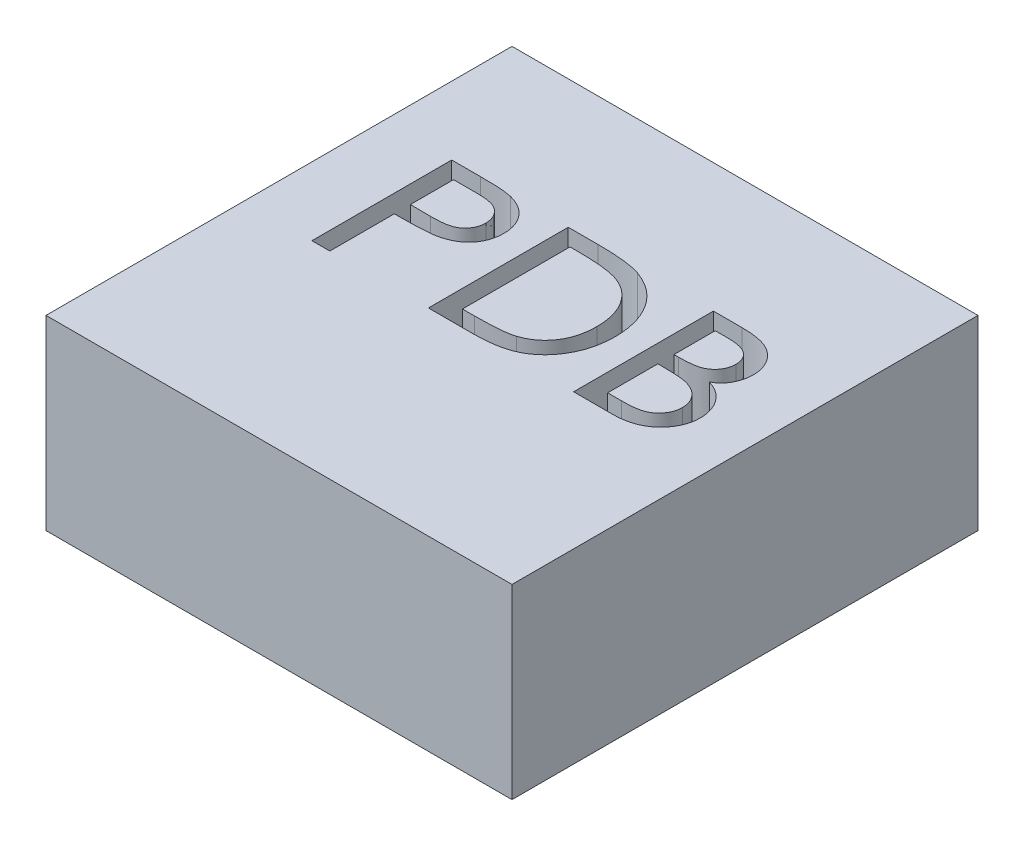
from build123d import *

# Parameters (mm, degrees)
SKETCH1_W           = 63.5
SKETCH1_H           = 63.5
BOSS_EXTRUDE1_DEPTH = 25.4
CUT_EXTRUDE1_DEPTH  = 12.7


with BuildPart() as part:
    # Sketch1 → Boss-Extrude1 (new body)
    with BuildSketch(Plane(origin=(0, 0, 0), x_dir=(1, 0, 0), z_dir=(0, 1, 0))):
        Rectangle(SKETCH1_W, SKETCH1_H)
    extrude(amount=BOSS_EXTRUDE1_DEPTH)

    # Sketch2 → Cut-Extrude1 (cut, symmetric)
    # profile 1 of 3: a face of its own
    with BuildSketch(Plane(origin=(0, 25.4, 0), x_dir=(1, 0, 0), z_dir=(0, 1, 0))):
        with BuildLine():
            Line((-22.444527911, 14.230872875), (-18.540651709, 14.230872875))
            add(Edge.make_bspline(
                [(-18.540651709, 14.230872875), (-18.282413534, 14.230732191), (-17.787511205, 14.230462577), (-17.077768337, 14.212192651), (-16.433871736, 14.196424192), (-15.854870009, 14.166115864), (-15.342081402, 14.124599264), (-14.895321834, 14.075780717), (-14.514111614, 14.020873337), (-14.284211976, 13.971232687), (-14.178842814, 13.948481048)],
                knots=[0, 0, 0, 0, 1.415450773, 2.712650385, 3.891531898, 4.945867971, 5.890285756, 6.71109784, 7.409261617, 8, 8, 8, 8], degree=3))
            add(Edge.make_bspline(
                [(-14.178842814, 13.948481048), (-14.030510742, 13.910336617), (-13.73789703, 13.835089347), (-13.319594841, 13.679982469), (-12.922682571, 13.503735476), (-12.548515352, 13.303248561), (-12.200915151, 13.071696923), (-11.872382672, 12.820119694), (-11.573023079, 12.535792454), (-11.292580558, 12.232508547), (-11.046518674, 11.903340726), (-10.826046516, 11.559427038), (-10.643308629, 11.195772234), (-10.493129004, 10.813728985), (-10.37572816, 10.415289186), (-10.291280039, 9.999183346), (-10.240536075, 9.566323923), (-10.235536068, 9.271346218), (-10.232989449, 9.12110725)],
                knots=[0, 0, 0, 0, 1.085641105, 2.141637125, 3.15936318, 4.164535163, 5.147931294, 6.118832473, 7.09541784, 8.072503165, 9.045079613, 10.006206652, 10.966486436, 11.926469503, 12.914201526, 13.908586125, 14.934794539, 16, 16, 16, 16], degree=3))
            add(Edge.make_bspline(
                [(-10.232989449, 9.12110725), (-10.23559194, 8.970875281), (-10.240723543, 8.674647164), (-10.291147068, 8.239200047), (-10.375671719, 7.8222298), (-10.489626704, 7.421894379), (-10.639388836, 7.040683537), (-10.818342186, 6.675378959), (-11.034662469, 6.330119459), (-11.281617579, 6.002508568), (-11.560500369, 5.697580965), (-11.867269054, 5.416494031), (-12.205956015, 5.16415684), (-12.573087622, 4.936040197), (-12.967384599, 4.728143957), (-13.39281361, 4.549330373), (-13.847476609, 4.396964169), (-14.163022987, 4.315946883), (-14.323854834, 4.274652923)],
                knots=[0, 0, 0, 0, 1.042501879, 2.055610221, 3.037454288, 3.993184118, 4.940927036, 5.876790881, 6.812738028, 7.76458517, 8.720845088, 9.677105007, 10.648370915, 11.647960469, 12.67482723, 13.739162042, 14.847666245, 16, 16, 16, 16], degree=3))
            add(Edge.make_bspline(
                [(-14.323854834, 4.274652923), (-14.44189289, 4.249061422), (-14.699390472, 4.193234092), (-15.126692218, 4.135141758), (-15.624585979, 4.087549087), (-16.194645379, 4.046142581), (-16.834533752, 4.011360746), (-17.547089373, 3.990655954), (-18.330687108, 3.973948722), (-18.877730092, 3.973443651), (-19.162676949, 3.973180567)],
                knots=[0, 0, 0, 0, 0.596754895, 1.30180848, 2.129432098, 3.068723067, 4.126429569, 5.296393252, 6.591729958, 8, 8, 8, 8], degree=3))
            Line((-19.162676949, 3.973180567), (-20.002220218, 3.973180567))
            Line((-20.002220218, 3.973180567), (-20.002220218, -4.819127125))
            Line((-20.002220218, -4.819127125), (-22.444527911, -4.819127125))
            Line((-22.444527911, -4.819127125), (-22.444527911, 14.230872875))
        make_face()
        with BuildLine():
            Line((-20.002220218, 12.032795952), (-20.002220218, 6.163625278))
            Line((-20.002220218, 6.163625278), (-17.254624064, 6.133096432))
            add(Edge.make_bspline(
                [(-17.254624064, 6.133096432), (-17.099429961, 6.135142872), (-16.800419793, 6.139085718), (-16.368924753, 6.15277574), (-15.972040955, 6.180599787), (-15.609001752, 6.213050453), (-15.279073759, 6.25854644), (-14.983742286, 6.315327633), (-14.720489127, 6.379124379), (-14.419455392, 6.479426985), (-14.08249515, 6.636041563), (-13.724269604, 6.875003016), (-13.408506136, 7.160783303), (-13.147733132, 7.497146144), (-12.937873818, 7.867751807), (-12.781880092, 8.263860841), (-12.693584837, 8.68473955), (-12.681444685, 8.971885741), (-12.675297141, 9.117291144)],
                knots=[0, 0, 0, 0, 1.196816259, 2.305888068, 3.328295896, 4.264290022, 5.116006351, 5.89509982, 6.582615619, 7.202969204, 8.339503699, 9.435837163, 10.511976311, 11.608836183, 12.702577786, 13.786378287, 14.879063815, 16, 16, 16, 16], degree=3))
            add(Edge.make_bspline(
                [(-12.675297141, 9.117291144), (-12.681489092, 9.257622271), (-12.693770592, 9.535963784), (-12.782527391, 9.945333321), (-12.93859311, 10.333633002), (-13.148794241, 10.699032642), (-13.404228107, 11.033013391), (-13.706801673, 11.320319414), (-14.049231193, 11.555128466), (-14.368915495, 11.705519515), (-14.653963235, 11.803391226), (-14.905191836, 11.860884025), (-15.189003396, 11.914638993), (-15.507160305, 11.960722122), (-15.859958556, 11.993958034), (-16.246972865, 12.015277072), (-16.666800222, 12.031983882), (-16.958220699, 12.032518316), (-17.109612045, 12.032795952)],
                knots=[0, 0, 0, 0, 1.113934591, 2.209447376, 3.306634974, 4.424089692, 5.547326231, 6.633252657, 7.723023745, 8.829884498, 9.427152571, 10.113060991, 10.873719268, 11.720735618, 12.664423995, 13.686322671, 14.798057257, 16, 16, 16, 16], degree=3))
            Line((-17.109612045, 12.032795952), (-20.002220218, 12.032795952))
        make_face(mode=Mode.SUBTRACT)
    # profile 2 of 3: a face of its own
    with BuildSketch(Plane(origin=(0, 25.4, 0), x_dir=(1, 0, 0), z_dir=(0, 1, 0))):
        with BuildLine():
            Line((-6.569527911, -4.819127125), (-6.569527911, 14.230872875))
            Line((-6.569527911, 14.230872875), (-2.535904113, 14.230872875))
            add(Edge.make_bspline(
                [(-2.535904113, 14.230872875), (-2.196247103, 14.228505378), (-1.542230632, 14.223946716), (-0.596751955, 14.194051147), (0.275193123, 14.14264518), (1.075473001, 14.065160182), (1.803283667, 13.974031011), (2.458393859, 13.853468735), (3.04330739, 13.723503194), (3.401470952, 13.603983375), (3.569865118, 13.547789942)],
                knots=[0, 0, 0, 0, 1.321377177, 2.544338591, 3.679698859, 4.71869479, 5.671952218, 6.531967125, 7.309789724, 8, 8, 8, 8], degree=3))
            add(Edge.make_bspline(
                [(3.569865118, 13.547789942), (3.805635435, 13.458948754), (4.270984662, 13.283599376), (4.930321596, 12.954445991), (5.55323615, 12.593329598), (6.131967016, 12.183419309), (6.665409047, 11.727297374), (7.162716968, 11.234926131), (7.608546279, 10.691950163), (8.016928285, 10.11369351), (8.378771733, 9.499487433), (8.691978595, 8.857399599), (8.9565084, 8.188662924), (9.174062375, 7.49497973), (9.340792993, 6.775101283), (9.463998084, 6.030986071), (9.537616026, 5.260708636), (9.545640105, 4.737832945), (9.549702859, 4.473090423)],
                knots=[0, 0, 0, 0, 1.037989101, 2.048720264, 3.03347809, 4.003905725, 4.967380877, 5.923996735, 6.884742632, 7.859453364, 8.839691521, 9.819957728, 10.801471334, 11.80152298, 12.813966534, 13.844978706, 14.908869198, 16, 16, 16, 16], degree=3))
            add(Edge.make_bspline(
                [(9.549702859, 4.473090423), (9.546153481, 4.243999132), (9.539142001, 3.791449706), (9.479832155, 3.121208091), (9.385968749, 2.469777057), (9.251800795, 1.837574233), (9.080250694, 1.22549455), (8.868901893, 0.631819067), (8.622518463, 0.055791029), (8.335274459, -0.496028099), (8.02041033, -1.021979812), (7.676173736, -1.514488826), (7.309423202, -1.973720735), (6.919315227, -2.39972136), (6.502221935, -2.790233914), (6.058690277, -3.144959693), (5.591342177, -3.467528995), (5.095658631, -3.755716268), (4.562376713, -4.011938087), (3.981666543, -4.226991844), (3.352379677, -4.408897909), (2.67514569, -4.563559838), (1.946406954, -4.673665072), (1.169771572, -4.756997052), (0.344800541, -4.813087082), (-0.221976124, -4.817076223), (-0.513368055, -4.819127125)],
                knots=[0, 0, 0, 0, 1.058131973, 2.090245403, 3.105765157, 4.096918797, 5.07359586, 6.040054961, 7.006085223, 7.965371986, 8.911666288, 9.835956746, 10.738988486, 11.624821356, 12.502036588, 13.375701924, 14.24610047, 15.122941669, 16.021834204, 16.975760622, 17.979893693, 19.046217526, 20.182340398, 21.382202726, 22.654134781, 24, 24, 24, 24], degree=3))
            Line((-0.513368055, -4.819127125), (-6.569527911, -4.819127125))
        make_face()
        with BuildLine():
            Line((-4.127220218, -2.621050202), (-2.471030314, -2.621050202))
            add(Edge.make_bspline(
                [(-2.471030314, -2.621050202), (-2.165717856, -2.619874288), (-1.579169681, -2.61761519), (-0.735786403, -2.592573612), (0.034382142, -2.562674464), (0.728865277, -2.507161615), (1.349184679, -2.445207508), (1.895353263, -2.365154971), (2.369603951, -2.275132842), (2.655781622, -2.190597041), (2.787563436, -2.151669193)],
                knots=[0, 0, 0, 0, 1.383618687, 2.658126108, 3.823786659, 4.876093986, 5.815132222, 6.648351516, 7.377580062, 8, 8, 8, 8], degree=3))
            add(Edge.make_bspline(
                [(2.787563436, -2.151669193), (2.951371582, -2.093104647), (3.274945344, -1.977420838), (3.738587238, -1.762151546), (4.175553982, -1.513837273), (4.58438011, -1.230241196), (4.968518834, -0.91509221), (5.328275847, -0.568746729), (5.657253942, -0.184083161), (5.957486574, 0.231250827), (6.22953002, 0.674426438), (6.465979465, 1.143992963), (6.665981347, 1.638999676), (6.823871434, 2.15824989), (6.951472932, 2.701084237), (7.042268762, 3.268490934), (7.095855328, 3.861479819), (7.103504703, 4.264366581), (7.107395166, 4.469274317)],
                knots=[0, 0, 0, 0, 0.982760408, 1.941267819, 2.884666843, 3.819923004, 4.749609063, 5.690155114, 6.638335438, 7.60609908, 8.583824457, 9.574050268, 10.573936541, 11.597196452, 12.638231748, 13.723193679, 14.842018967, 16, 16, 16, 16], degree=3))
            add(Edge.make_bspline(
                [(7.107395166, 4.469274317), (7.104328968, 4.684426149), (7.098292516, 5.107997419), (7.032779482, 5.730817064), (6.941216587, 6.330969427), (6.803310285, 6.906676927), (6.621595749, 7.456153886), (6.41073166, 7.985621435), (6.151976287, 8.486921039), (5.859327981, 8.963297807), (5.53237813, 9.409786031), (5.170986229, 9.819568311), (4.781819602, 10.197003539), (4.355450167, 10.530708224), (3.903972219, 10.836584191), (3.418104035, 11.097444363), (2.903147592, 11.326469565), (2.543199775, 11.445595562), (2.360159589, 11.506173355)],
                knots=[0, 0, 0, 0, 1.129217777, 2.223100788, 3.284889252, 4.31516385, 5.326848226, 6.321524555, 7.304244934, 8.284784113, 9.254596696, 10.205833222, 11.15055266, 12.096616828, 13.045035565, 14.010353181, 14.988227444, 16, 16, 16, 16], degree=3))
            add(Edge.make_bspline(
                [(2.360159589, 11.506173355), (2.205422509, 11.548738223), (1.876729735, 11.639154587), (1.34098632, 11.743553311), (0.737282964, 11.83304653), (0.062827844, 11.909747487), (-0.67931206, 11.965718617), (-1.492594577, 12.000787971), (-2.374146447, 12.030249407), (-2.986175805, 12.031927452), (-3.302941372, 12.032795952)],
                knots=[0, 0, 0, 0, 0.675026783, 1.433893058, 2.294494921, 3.24250292, 4.28921909, 5.425097092, 6.667317884, 8, 8, 8, 8], degree=3))
            Line((-3.302941372, 12.032795952), (-4.127220218, 12.032795952))
            Line((-4.127220218, 12.032795952), (-4.127220218, -2.621050202))
        make_face(mode=Mode.SUBTRACT)
    # profile 3 of 3: a face of its own
    with BuildSketch(Plane(origin=(0, 25.4, 0), x_dir=(1, 0, 0), z_dir=(0, 1, 0))):
        with BuildLine():
            Line((13.213164397, 14.230872875), (17.082695647, 14.230872875))
            add(Edge.make_bspline(
                [(17.082695647, 14.230872875), (17.272281586, 14.230222154), (17.640276487, 14.228959074), (18.176035737, 14.195910005), (18.679971275, 14.150414585), (19.153398221, 14.093084072), (19.593236575, 14.006410744), (20.001925804, 13.909959925), (20.378300443, 13.791488466), (20.830246432, 13.609998296), (21.347153653, 13.342399661), (21.895047003, 12.940453218), (22.371563054, 12.469870026), (22.765719548, 11.932176295), (23.07753515, 11.348870047), (23.306642827, 10.736128953), (23.443722761, 10.097717523), (23.461780803, 9.663641268), (23.470856705, 9.44547624)],
                knots=[0, 0, 0, 0, 1.007958579, 1.956493294, 2.853051435, 3.69876748, 4.490758369, 5.235590101, 5.930857791, 6.586533057, 7.824014415, 9.014592828, 10.186442765, 11.371570779, 12.545761065, 13.692928573, 14.840474926, 16, 16, 16, 16], degree=3))
            add(Edge.make_bspline(
                [(23.470856705, 9.44547624), (23.463069213, 9.24149723), (23.447678212, 8.838358292), (23.338319353, 8.243976604), (23.15476841, 7.673093738), (22.898600972, 7.134631964), (22.589074228, 6.637439821), (22.20759657, 6.213869888), (21.77873486, 5.853053341), (21.451862, 5.678626393), (21.288044205, 5.591209413)],
                knots=[0, 0, 0, 0, 1.049068526, 2.073352407, 3.097740801, 4.125217979, 5.134529868, 6.0985968, 7.047080017, 8, 8, 8, 8], degree=3))
            add(Edge.make_bspline(
                [(21.288044205, 5.591209413), (21.482926671, 5.526505168), (21.862101773, 5.40061268), (22.393092262, 5.149391922), (22.873844444, 4.856423659), (23.299637724, 4.513861146), (23.672862753, 4.133806844), (24.005562026, 3.726909375), (24.289203724, 3.286823621), (24.519794525, 2.815302424), (24.710005792, 2.325007118), (24.836843862, 1.813119378), (24.921626266, 1.288193932), (24.931339852, 0.932081413), (24.93624132, 0.752387298)],
                knots=[0, 0, 0, 0, 1.133419977, 2.205250392, 3.236826218, 4.236512947, 5.215313127, 6.174419893, 7.135300951, 8.100002318, 9.069604306, 10.034177721, 11.008047523, 12, 12, 12, 12], degree=3))
            add(Edge.make_bspline(
                [(24.93624132, 0.752387298), (24.931137369, 0.566406117), (24.921055607, 0.199040185), (24.839902798, -0.342733109), (24.700034458, -0.863232532), (24.514211829, -1.367769877), (24.266856385, -1.850005908), (23.967683829, -2.314002623), (23.613823911, -2.757705044), (23.21270802, -3.179310372), (22.763168003, -3.565462241), (22.269953482, -3.901176702), (21.737693164, -4.185955693), (21.166492599, -4.420039629), (20.553092508, -4.597160558), (19.902263914, -4.727320393), (19.21262493, -4.803613998), (18.740347744, -4.813872984), (18.498470887, -4.819127125)],
                knots=[0, 0, 0, 0, 0.936774787, 1.85039767, 2.752028152, 3.648404466, 4.554125646, 5.47676296, 6.425627069, 7.40928418, 8.404729492, 9.405524488, 10.409085955, 11.440939351, 12.509690097, 13.620780345, 14.781482169, 16, 16, 16, 16], degree=3))
            Line((18.498470887, -4.819127125), (13.213164397, -4.819127125))
            Line((13.213164397, -4.819127125), (13.213164397, 14.230872875))
        make_face()
        with BuildLine():
            Line((15.655472089, 12.032795952), (15.655472089, 6.415488259))
            Line((15.655472089, 6.415488259), (16.269865118, 6.415488259))
            add(Edge.make_bspline(
                [(16.269865118, 6.415488259), (16.428901493, 6.415368224), (16.734384872, 6.415137656), (17.175778171, 6.437093921), (17.583172158, 6.461644038), (17.957606855, 6.49901069), (18.29712401, 6.549702161), (18.605263378, 6.603996536), (18.87752326, 6.676742544), (19.193475629, 6.781958778), (19.543003079, 6.949059117), (19.919732828, 7.194971495), (20.248115707, 7.492524069), (20.524841169, 7.836299581), (20.751945013, 8.21272563), (20.911881124, 8.616412225), (21.012867944, 9.039830783), (21.023269356, 9.329149616), (21.028549012, 9.476005086)],
                knots=[0, 0, 0, 0, 1.189795604, 2.285406617, 3.306016107, 4.243629591, 5.09972607, 5.874440047, 6.583200089, 7.20625147, 8.364329942, 9.470433385, 10.562068177, 11.665054906, 12.761988123, 13.838370909, 14.902777763, 16, 16, 16, 16], degree=3))
            add(Edge.make_bspline(
                [(21.028549012, 9.476005086), (21.02718674, 9.572878877), (21.024519934, 9.762520479), (20.979307136, 10.036849751), (20.916374133, 10.297803239), (20.819891937, 10.540193894), (20.700872455, 10.768651284), (20.554869135, 10.981435838), (20.377351628, 11.174302623), (20.178251027, 11.356808522), (19.947020593, 11.518883203), (19.681023739, 11.653954073), (19.384511866, 11.774995882), (19.052083291, 11.866404511), (18.68675303, 11.944609636), (18.287265689, 11.995773338), (17.854019069, 12.025873713), (17.55467326, 12.030432015), (17.399432426, 12.032795952)],
                knots=[0, 0, 0, 0, 0.920588044, 1.802157111, 2.638793445, 3.470424406, 4.277107445, 5.086238418, 5.917516993, 6.765890369, 7.652348103, 8.594329737, 9.598999334, 10.694623565, 11.869668103, 13.151790333, 14.522917531, 16, 16, 16, 16], degree=3))
            Line((17.399432426, 12.032795952), (15.655472089, 12.032795952))
        make_face(mode=Mode.SUBTRACT)
        with BuildLine():
            Line((15.655472089, 4.217411336), (15.655472089, -2.621050202))
            Line((15.655472089, -2.621050202), (17.525363916, -2.621050202))
            add(Edge.make_bspline(
                [(17.525363916, -2.621050202), (17.689457899, -2.618912994), (18.006263875, -2.614786821), (18.463324504, -2.602269564), (18.885800305, -2.570586056), (19.272808467, -2.529539613), (19.626285801, -2.478266194), (19.941402733, -2.408141527), (20.224574401, -2.334065), (20.550491341, -2.213045258), (20.9152495, -2.025355454), (21.311857153, -1.753489014), (21.656194679, -1.420849702), (21.952593413, -1.044634266), (22.193895127, -0.634386403), (22.365676042, -0.200519054), (22.474674714, 0.248409339), (22.487491931, 0.553341006), (22.493933628, 0.706594028)],
                knots=[0, 0, 0, 0, 1.163785926, 2.246848597, 3.241725633, 4.167152819, 5.00659376, 5.772700295, 6.455464292, 7.08048881, 8.234268396, 9.355318846, 10.478218647, 11.615125307, 12.742977958, 13.840148171, 14.914498376, 16, 16, 16, 16], degree=3))
            add(Edge.make_bspline(
                [(22.493933628, 0.706594028), (22.486276418, 0.898432358), (22.47123748, 1.275207324), (22.317937113, 1.817815673), (22.07819003, 2.323534335), (21.743566539, 2.785199929), (21.32575584, 3.196163377), (20.826705458, 3.537664964), (20.253592747, 3.807752153), (19.838700399, 3.92686809), (19.624222089, 3.98844499)],
                knots=[0, 0, 0, 0, 0.973192407, 1.911372656, 2.842841623, 3.806662698, 4.794486549, 5.808057144, 6.866876674, 8, 8, 8, 8], degree=3))
            add(Edge.make_bspline(
                [(19.624222089, 3.98844499), (19.535358481, 4.007266957), (19.344563324, 4.047678778), (19.033207307, 4.090202647), (18.679962039, 4.134638623), (18.281082797, 4.161087316), (17.838657763, 4.191030766), (17.351113083, 4.202255007), (16.819459351, 4.215949346), (16.450507034, 4.216910779), (16.258416801, 4.217411336)],
                knots=[0, 0, 0, 0, 0.644909758, 1.384657469, 2.230684102, 3.173004705, 4.222865052, 5.379792601, 6.635823043, 8, 8, 8, 8], degree=3))
            Line((16.258416801, 4.217411336), (15.655472089, 4.217411336))
        make_face(mode=Mode.SUBTRACT)
    extrude(amount=CUT_EXTRUDE1_DEPTH, both=True, mode=Mode.SUBTRACT)


solid = part.part
